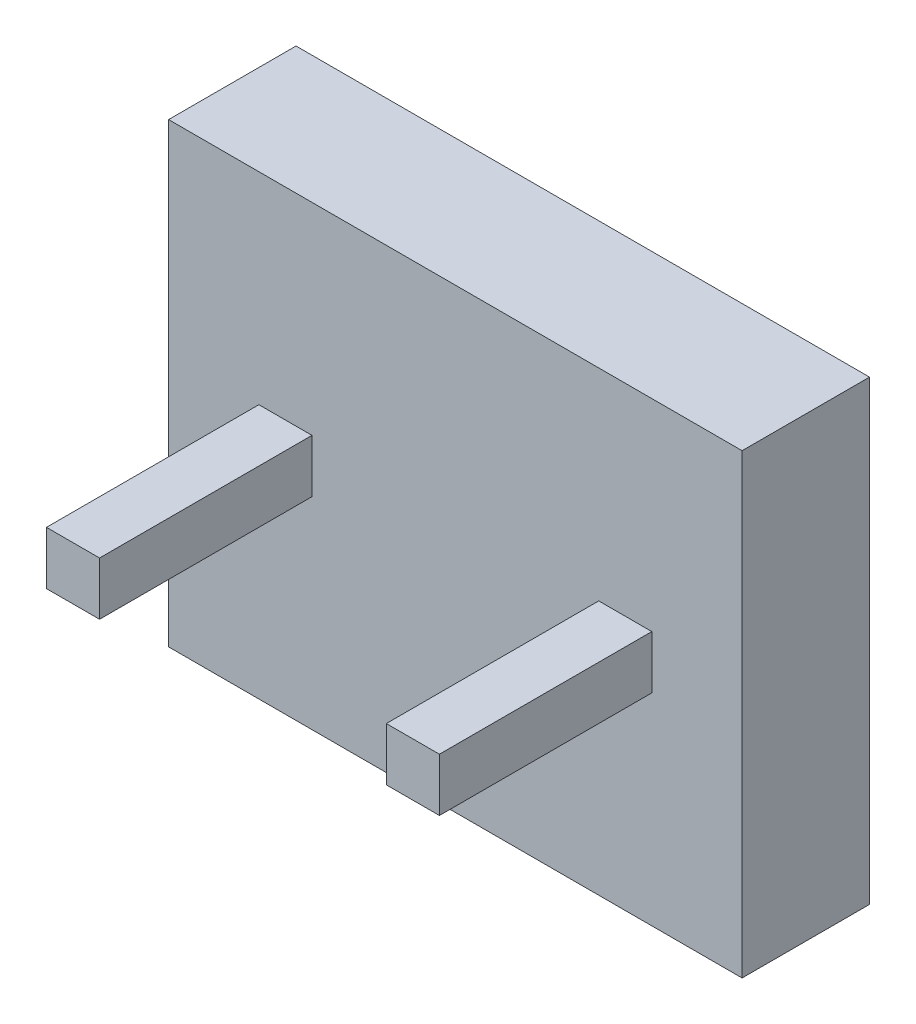
from build123d import *

# Parameters (mm, degrees)
SKETCH1_W   = 5.4
SKETCH1_H   = 4.3
BODY_DEPTH  = 1.2
LEADS_START = 1.2
SKETCH2_W   = 0.5
SKETCH2_H   = 0.5
LEADS_DEPTH = 2


with BuildPart() as part:
    # Sketch1 → Body (new body)
    with BuildSketch(Plane.XY):
        Rectangle(SKETCH1_W, SKETCH1_H)
    extrude(amount=BODY_DEPTH)

    # Sketch2 → Leads (add)
    with BuildSketch(Plane.XY.offset(LEADS_START)):
        with Locations((-1.6, 0)):
            Rectangle(SKETCH2_W, SKETCH2_H)
        with Locations((1.6, 0)):
            Rectangle(SKETCH2_W, SKETCH2_H)
    extrude(amount=LEADS_DEPTH)


solid = part.part
